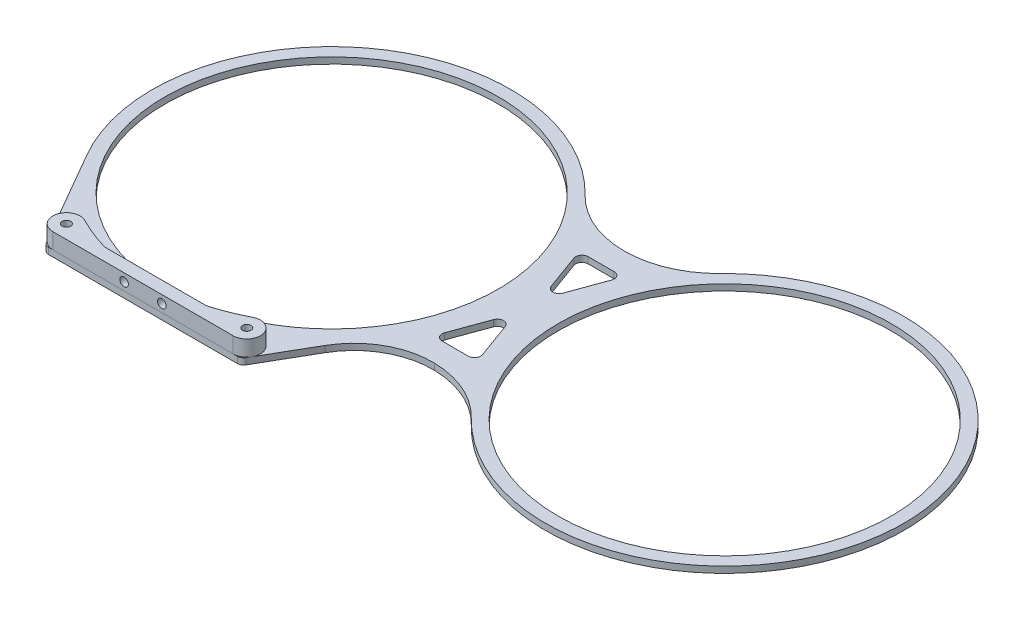
from build123d import *

# Parameters (mm, degrees)
SKETCH_1_R          = 53
SKETCH_1_R_2        = 1.35
EXTRUDE_1_DEPTH     = 2
FILLET_1_R          = 2
FILLET_2_R          = 25
SKETCH_12_R         = 1.35
EXTRUDE_6_DEPTH     = 5
SKETCH_13_R         = 1.35
CUT_EXTRUDE_1_DEPTH = 217.47632665


with BuildPart() as part:
    # 草图1 → 凸台-拉伸1 (new body)
    with BuildSketch(Plane(origin=(0, 0, 0), x_dir=(1, 0, 0), z_dir=(0, 1, 0))):
        with BuildLine():
            Line((-31.176914536, -60), (31.176914536, -60))
            Line((31.176914536, -60), (44.905077049, -36.222125034))
            ThreePointArc((44.905077049, -36.222125034), (65.118045578, -30.635112004), (84.051724138, -39.651465344))
            ThreePointArc((84.051724138, -39.651465344), (182, 0), (84.051724138, 39.651465344))
            ThreePointArc((84.051724138, 39.651465344), (62.5, 30.52065763), (40.948275862, 39.651465344))
            ThreePointArc((40.948275862, 39.651465344), (-34.334521079, 45.498798471), (-49.363448016, -28.5))
            Line((-49.363448016, -28.5), (-31.176914536, -60))
        make_face()
        with Locations(Location((0, 0, 0), (0, 0, 270))):
            Circle(SKETCH_1_R, mode=Mode.SUBTRACT)
        with Locations(Location((125, 0, 0), (0, 0, 270))):
            Circle(SKETCH_1_R, mode=Mode.SUBTRACT)
        with Locations(Location((-28.676914536, -55.669872981, 0), (0, 0, 270))):
            Circle(SKETCH_1_R_2, mode=Mode.SUBTRACT)
        with Locations(Location((28.676914536, -55.669872981, 0), (0, 0, 90))):
            Circle(SKETCH_1_R_2, mode=Mode.SUBTRACT)
        Polygon((55.5, 23.232341936), (62.5, 4), (69.5, 23.232341936), align=None, mode=Mode.SUBTRACT)
        Polygon((55.5, -23.232341936), (69.5, -23.232341936), (62.5, -4), align=None, mode=Mode.SUBTRACT)
    extrude(amount=EXTRUDE_1_DEPTH)

    # 圆角1
    fillet_1_edges = [part.edges().sort_by_distance(p)[0] for p in [
        (31.176914536, 1, 60),
        (-31.176914536, 1, 60),
        (69.5, 1, -23.232341936),
        (55.5, 1, -23.232341936),
        (62.5, 1, -4),
        (62.5, 1, 4),
        (55.5, 1, 23.232341936),
        (69.5, 1, 23.232341936),
    ]]
    fillet(fillet_1_edges, radius=FILLET_1_R)

    # 圆角2
    fillet_2_edges = [part.edges().sort_by_distance(p)[0] for p in [
        (44.905077049, 1, 36.222125034),
    ]]
    fillet(fillet_2_edges, radius=FILLET_2_R)


with BuildPart() as body_2:
    # 草图12 → 凸台-拉伸6 (new body)
    with BuildSketch(Plane(origin=(0, 2, 0), x_dir=(1, 0, 0), z_dir=(0, 1, 0))):
        with BuildLine():
            Line((-28.676914536, -60), (28.676914536, -60))
            ThreePointArc((28.676914536, -60), (32.885147917, -54.649690735), (26.693986569, -51.820457873))
            ThreePointArc((26.693986569, -51.820457873), (21.540709312, -54.165732852), (16.1842137, -56))
            Line((16.1842137, -56), (-16.1842137, -56))
            ThreePointArc((-16.1842137, -56), (-21.540709312, -54.165732852), (-26.693986569, -51.820457873))
            ThreePointArc((-26.693986569, -51.820457873), (-32.885147917, -54.649690735), (-28.676914536, -60))
        make_face()
        with Locations(Location((-28.676914536, -55.669872981, 0), (0, 0, 270))):
            Circle(SKETCH_12_R, mode=Mode.SUBTRACT)
        with Locations(Location((28.676914536, -55.669872981, 0), (0, 0, 270))):
            Circle(SKETCH_12_R, mode=Mode.SUBTRACT)
    extrude(amount=EXTRUDE_6_DEPTH)

    # 草图13 → 切除-拉伸1 (cut, through all)
    with BuildSketch(Plane.XY.offset(60)):
        with Locations((-6, 4.5)):
            Circle(SKETCH_13_R)
        with Locations((6, 4.5)):
            Circle(SKETCH_13_R)
    extrude(amount=-CUT_EXTRUDE_1_DEPTH, mode=Mode.SUBTRACT)


solid = Compound([part.part, body_2.part])
